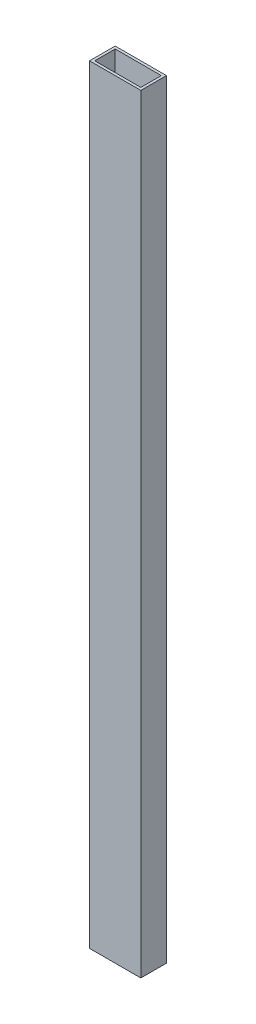
from build123d import *

# Parameters (mm, degrees)
SKETCH1_W           = 50.8
SKETCH1_H           = 25.4
BOSS_EXTRUDE1_DEPTH = 762
SKETCH2_W           = 45.72
SKETCH2_H           = 20.32
CUT_EXTRUDE1_DEPTH  = 762


with BuildPart() as part:
    # Sketch1 → Boss-Extrude1 (new body)
    with BuildSketch(Plane(origin=(0, 0, 0), x_dir=(1, 0, 0), z_dir=(0, 1, 0))):
        with Locations((25.4, 12.7)):
            Rectangle(SKETCH1_W, SKETCH1_H)
    extrude(amount=BOSS_EXTRUDE1_DEPTH)

    # Sketch2 → Cut-Extrude1 (cut)
    with BuildSketch(Plane(origin=(0, 762, 0), x_dir=(1, 0, 0), z_dir=(0, 1, 0))):
        with Locations((25.4, 12.7)):
            Rectangle(SKETCH2_W, SKETCH2_H)
    extrude(amount=-CUT_EXTRUDE1_DEPTH, mode=Mode.SUBTRACT)


solid = part.part
